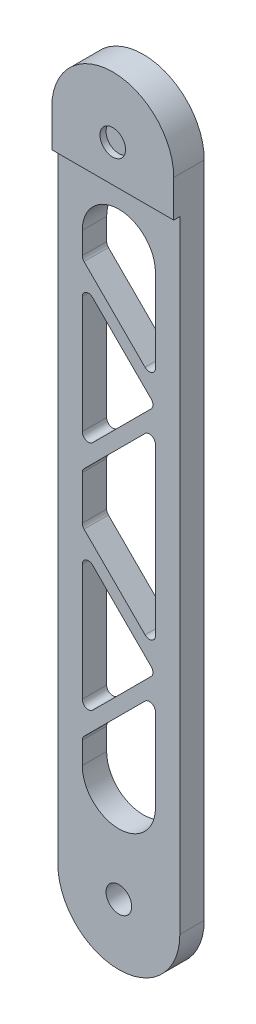
from build123d import *

# Parameters (mm, degrees)
CROQUIS1_R              = 2.1
SALIENTE_EXTRUIR1_DEPTH = 4
CROQUIS1_6_R            = 2.1
SALIENTE_EXTRUIR3_DEPTH = 5
REDONDEO1_R             = 1


with BuildPart() as part:
    # Croquis1 → Saliente-Extruir1 (new body)
    with BuildSketch(Plane.XY):
        with BuildLine():
            ThreePointArc((10, 54), (0, 64), (-10, 54))
            Line((-10, 54), (-10, -54))
            ThreePointArc((-10, -54), (0, -64), (10, -54))
            Line((10, -54), (10, 54))
        make_face()
        with BuildLine():
            Line((6, 38), (6, 22))
            Line((6, 22), (-6, 34))
            Line((-6, 34), (-6, 38))
            ThreePointArc((-6, 38), (0, 44), (6, 38))
        make_face(mode=Mode.SUBTRACT)
        Polygon((-6, 7), (-6, 31), (6, 19), align=None, mode=Mode.SUBTRACT)
        Polygon((-6, -4), (-6, 4), (6, 16), (6, -16), align=None, mode=Mode.SUBTRACT)
        Polygon((-6, -31), (-6, -7), (6, -19), align=None, mode=Mode.SUBTRACT)
        with BuildLine():
            Line((-6, -38), (-6, -34))
            Line((-6, -34), (6, -22))
            Line((6, -22), (6, -38))
            ThreePointArc((6, -38), (0, -44), (-6, -38))
        make_face(mode=Mode.SUBTRACT)
        with Locations((0, -54)):
            Circle(CROQUIS1_R, mode=Mode.SUBTRACT)
    extrude(amount=SALIENTE_EXTRUIR1_DEPTH)

    # Croquis1<6> → Saliente-Extruir3 (add)
    with BuildSketch(Plane.XY):
        with BuildLine():
            Line((10, 47.95), (10, 54))
            ThreePointArc((10, 54), (0, 64), (-10, 54))
            Line((-10, 54), (-10, 47.95))
            Line((-10, 47.95), (10, 47.95))
        make_face()
        with Locations((0, 54)):
            Circle(CROQUIS1_6_R, mode=Mode.SUBTRACT)
    extrude(amount=SALIENTE_EXTRUIR3_DEPTH)

    # Redondeo1
    redondeo1_edges = [part.edges().sort_by_distance(p)[0] for p in [
        (6, 22, 2),
        (6, 16, 2),
        (6, 19, 2),
        (-6, 31, 2),
        (-6, 7, 2),
        (6, -22, 2),
        (6, -16, 2),
        (6, -19, 2),
        (-6, -31, 2),
        (-6, -7, 2),
        (-6, 34, 2),
        (-6, -4, 2),
        (-6, -34, 2),
        (-6, 4, 2),
    ]]
    fillet(redondeo1_edges, radius=REDONDEO1_R)


solid = part.part
